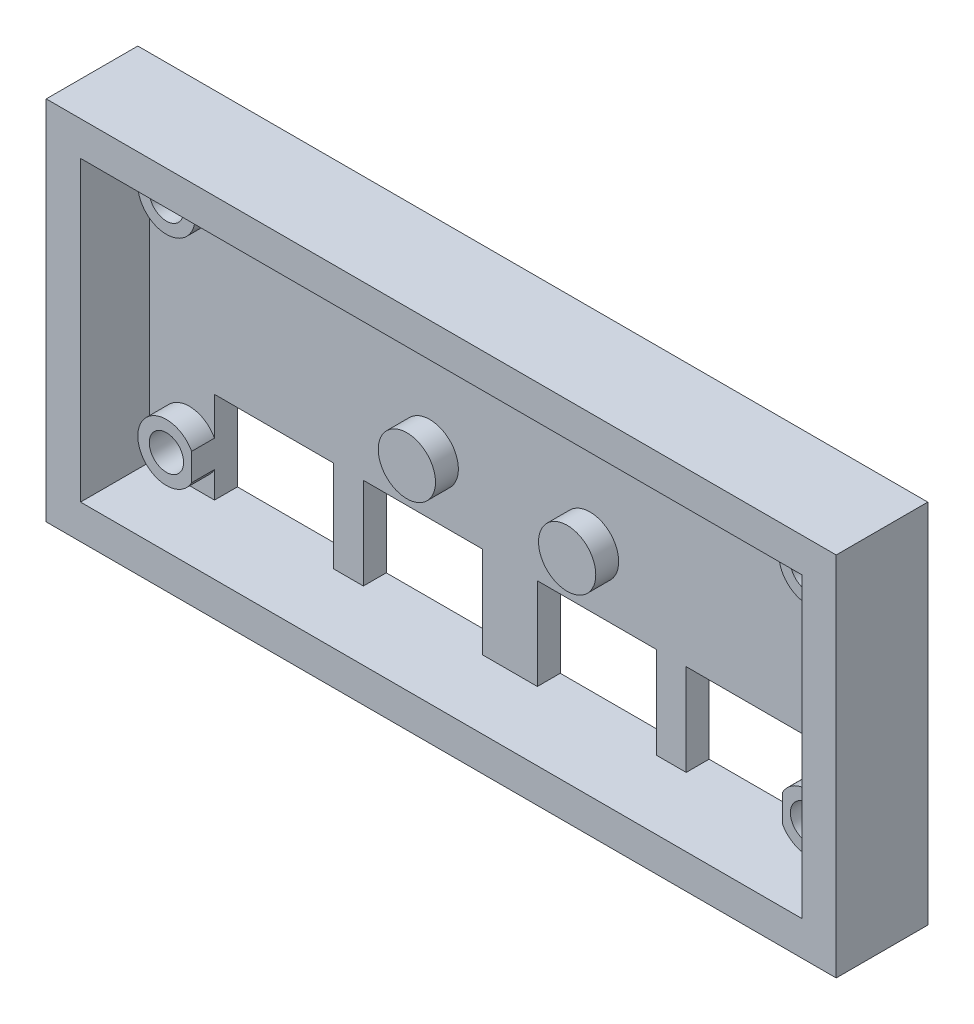
from build123d import *

# Parameters (mm, degrees)
SKETCH1_W               = 69
SKETCH1_H               = 32
BOSS_EXTRUDE1_DEPTH     = 2
SKETCH2_W               = 69
SKETCH2_H               = 32
SKETCH2_W_2             = 63
SKETCH2_H_2             = 26
BOSS_EXTRUDE2_DEPTH     = 6
SKETCH3_R               = 2.5
SKETCH3_R_2             = 1.5
BOSS_EXTRUDE3_DEPTH     = 2
CUT_EXTRUDE1_DEPTH      = 39.5
CUT_EXTRUDE1_DEPTH_BACK = 39.5
SKETCH4_R               = 1.5
SKETCH4_W               = 10.4
SKETCH4_H               = 8


with BuildPart() as part:
    # Sketch1 → Boss-Extrude1 (new body)
    with BuildSketch(Plane.XY):
        Rectangle(SKETCH1_W, SKETCH1_H)
    extrude(amount=BOSS_EXTRUDE1_DEPTH)

    # Sketch2 → Boss-Extrude2 (add)
    with BuildSketch(Plane.XY.offset(2)):
        Rectangle(SKETCH2_W, SKETCH2_H)
        Rectangle(SKETCH2_W_2, SKETCH2_H_2, mode=Mode.SUBTRACT)
    extrude(amount=BOSS_EXTRUDE2_DEPTH)

    # Sketch3 → Boss-Extrude3 (add)
    # profile 1 of 6: a face of its own
    with BuildSketch(Plane.XY.offset(2)):
        with Locations((-28, 9.5)):
            Circle(SKETCH3_R)
        with Locations((-28, 9.5)):
            Circle(SKETCH3_R_2, mode=Mode.SUBTRACT)
    # profile 2 of 6: a face of its own
    with BuildSketch(Plane.XY.offset(2)):
        with Locations((-28, -9.5)):
            Circle(SKETCH3_R)
        with Locations((-28, -9.5)):
            Circle(SKETCH3_R_2, mode=Mode.SUBTRACT)
    # profile 3 of 6: a face of its own
    with BuildSketch(Plane.XY.offset(2)):
        with Locations((28, -9.5)):
            Circle(SKETCH3_R)
        with Locations((28, -9.5)):
            Circle(SKETCH3_R_2, mode=Mode.SUBTRACT)
    # profile 4 of 6: a face of its own
    with BuildSketch(Plane.XY.offset(2)):
        with Locations((28, 9.5)):
            Circle(SKETCH3_R)
        with Locations((28, 9.5)):
            Circle(SKETCH3_R_2, mode=Mode.SUBTRACT)
    # profile 5 of 6: a face of its own
    with BuildSketch(Plane.XY.offset(2)):
        with Locations((-7, 0)):
            Circle(SKETCH3_R)
    # profile 6 of 6: a face of its own
    with BuildSketch(Plane.XY.offset(2)):
        with Locations((7, 0)):
            Circle(SKETCH3_R)
    extrude(amount=BOSS_EXTRUDE3_DEPTH)

    # Sketch4 → Cut-Extrude1 (cut, two sides: drawn at the far end of the back side and taken through both)
    with BuildSketch(Plane.XY.offset(2).offset(-CUT_EXTRUDE1_DEPTH_BACK)):
        with Locations((28, 9.5)):
            Circle(SKETCH4_R)
        with Locations((28, -9.5)):
            Circle(SKETCH4_R)
        with Locations((-28, -9.5)):
            Circle(SKETCH4_R)
        with Locations((-28, 9.5)):
            Circle(SKETCH4_R)
        with Locations((-20.6, -9)):
            Rectangle(SKETCH4_W, SKETCH4_H)
        with Locations((-7.6, -9)):
            Rectangle(SKETCH4_W, SKETCH4_H)
        with Locations((7.6, -9)):
            Rectangle(SKETCH4_W, SKETCH4_H)
        with Locations((20.6, -9)):
            Rectangle(SKETCH4_W, SKETCH4_H)
    extrude(amount=CUT_EXTRUDE1_DEPTH + CUT_EXTRUDE1_DEPTH_BACK, mode=Mode.SUBTRACT)


solid = part.part
